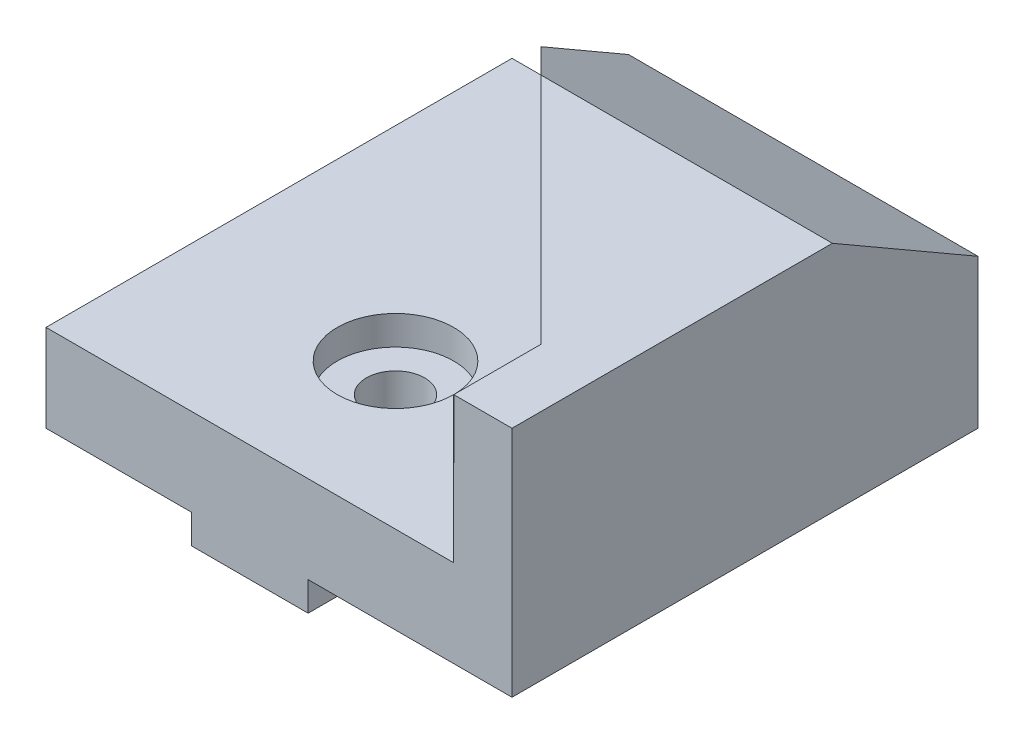
from build123d import *

# Parameters (mm, degrees)
BOSS_EXTRUDE1_DEPTH = 80
CUT_EXTRUDE1_DEPTH  = 25
CUT_EXTRUDE2_DEPTH  = 110.658560997
SKETCH4_R           = 5
CUT_EXTRUDE3_DEPTH  = 116.866302263
SKETCH5_R           = 10
CUT_EXTRUDE5_DEPTH  = 5


with BuildPart() as part:
    # Sketch1 → Boss-Extrude1 (new body)
    with BuildSketch(Plane.XY):
        Polygon((0, 5), (25, 5), (25, 0), (45, 0), (45, 5), (80, 5), (80, 45), (20, 45), (20, 20), (0, 20), align=None)
    extrude(amount=BOSS_EXTRUDE1_DEPTH)

    # Sketch2 → Cut-Extrude1 (cut)
    with BuildSketch(Plane(origin=(0, 45, 0), x_dir=(1, 0, 0), z_dir=(0, 1, 0))):
        Polygon((70, -80), (70, -65), (20, -15), (20, -80), align=None)
    extrude(amount=-CUT_EXTRUDE1_DEPTH, mode=Mode.SUBTRACT)

    # Sketch3 → Cut-Extrude2 (cut, through all)
    with BuildSketch(Plane.ZY.offset(-20)):
        Polygon((25, 45), (0, 30.56624327), (0, 45), align=None)
    extrude(amount=-CUT_EXTRUDE2_DEPTH, mode=Mode.SUBTRACT)

    # Sketch4 → Cut-Extrude3 (cut, through all)
    with BuildSketch(Plane(origin=(0, 20, 0), x_dir=(1, 0, 0), z_dir=(0, 1, 0))):
        with Locations(Location((35, -55, 0), (0, 0, 270))):
            Circle(SKETCH4_R)
    extrude(amount=-CUT_EXTRUDE3_DEPTH, mode=Mode.SUBTRACT)

    # Sketch5 → Cut-Extrude5 (cut)
    with BuildSketch(Plane(origin=(0, 20, 0), x_dir=(1, 0, 0), z_dir=(0, 1, 0))):
        with Locations(Location((35, -55, 0), (0, 0, 270))):
            Circle(SKETCH5_R)
    extrude(amount=-CUT_EXTRUDE5_DEPTH, mode=Mode.SUBTRACT)


solid = part.part
